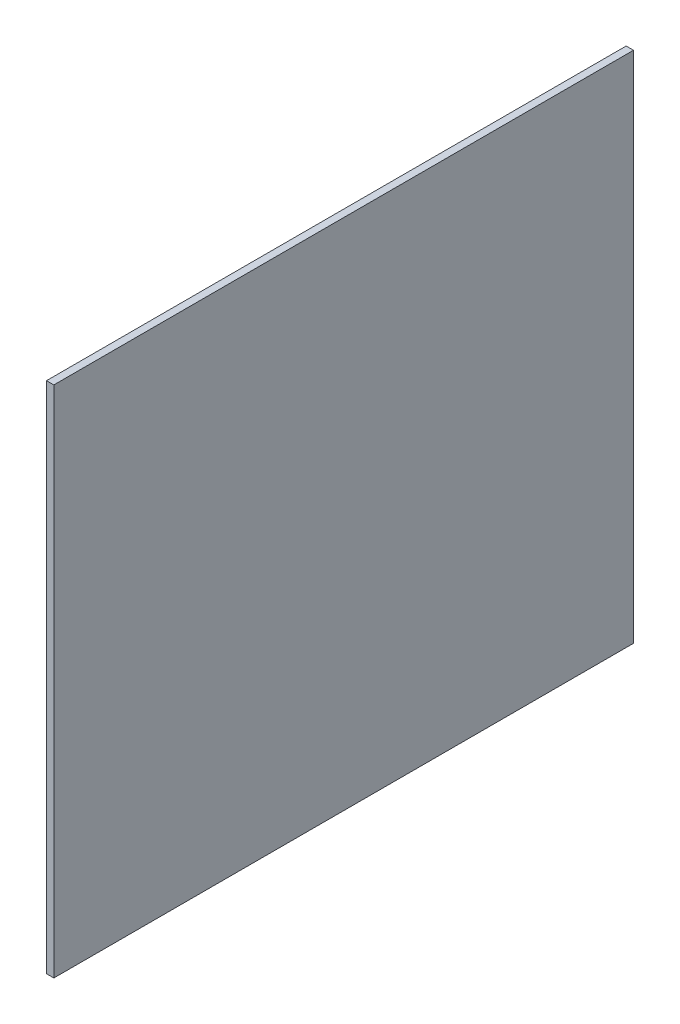
from build123d import *

# Parameters (mm, degrees)
CROQUIS1_W              = 395
CROQUIS1_H              = 350
SALIENTE_EXTRUIR1_DEPTH = 5


with BuildPart() as part:
    # Croquis1 → Saliente-Extruir1 (new body)
    with BuildSketch(Plane(origin=(0, 0, 0), x_dir=(0, 0, -1), z_dir=(1, 0, 0))):
        with Locations((56.169724771, 111.129587156)):
            Rectangle(CROQUIS1_W, CROQUIS1_H)
    extrude(amount=SALIENTE_EXTRUIR1_DEPTH)


solid = part.part
